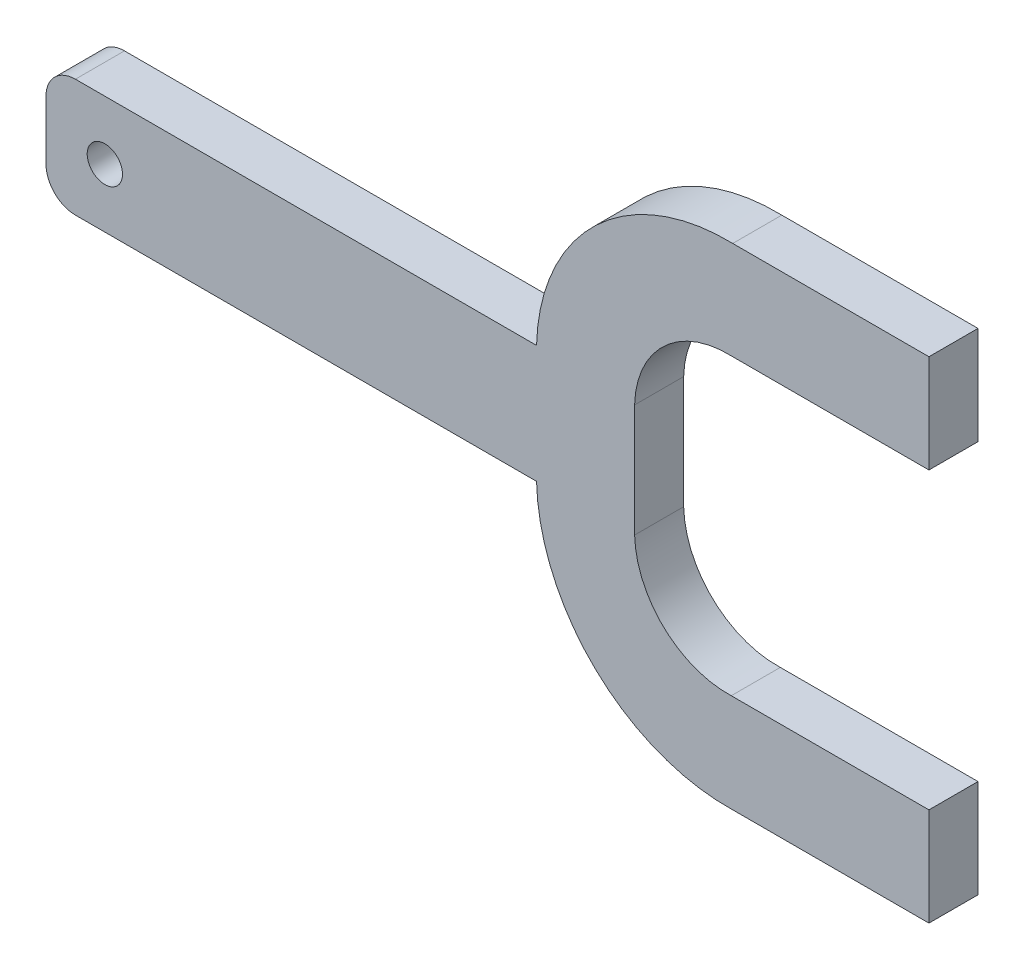
from build123d import *

# Parameters (mm, degrees)
SKETCH1_R           = 1.8
BOSS_EXTRUDE2_DEPTH = 5


with BuildPart() as part:
    # Sketch1 → Boss-Extrude2 (new body)
    # profile 1 of 2: a face of its own
    with BuildSketch(Plane.XY):
        with BuildLine():
            ThreePointArc((0, 9), (0.878679656, 11.121320344), (3, 12))
            Line((3, 12), (50, 12))
            Line((50, 12), (50, 0))
            Line((50, 0), (3, 0))
            ThreePointArc((3, 0), (0.878679656, 0.878679656), (0, 3))
            Line((0, 3), (0, 9))
        make_face()
        with Locations((6, 6)):
            Circle(SKETCH1_R, mode=Mode.SUBTRACT)
    # profile 2 of 2: a face of its own
    with BuildSketch(Plane.XY):
        with BuildLine():
            Line((90, -9), (69.8490214, -9))
            ThreePointArc((69.8490214, -9), (62.990773359, -6.428332012), (59.996714309, 0.256326008))
            Line((59.996714309, 0.256326008), (59.996714309, 11.743673992))
            ThreePointArc((59.996714309, 11.743673992), (62.990773359, 18.428332012), (69.8490214, 21))
            Line((69.8490214, 21), (90, 21))
            Line((90, 21), (90, 31))
            Line((90, 31), (70, 31))
            ThreePointArc((70, 31), (56.064971157, 25.642135624), (50, 12))
            Line((50, 12), (50, 0))
            ThreePointArc((50, 0), (56.064971157, -13.642135624), (70, -19))
            Line((70, -19), (90, -19))
            Line((90, -19), (90, -9))
        make_face()
    extrude(amount=BOSS_EXTRUDE2_DEPTH)


solid = part.part
